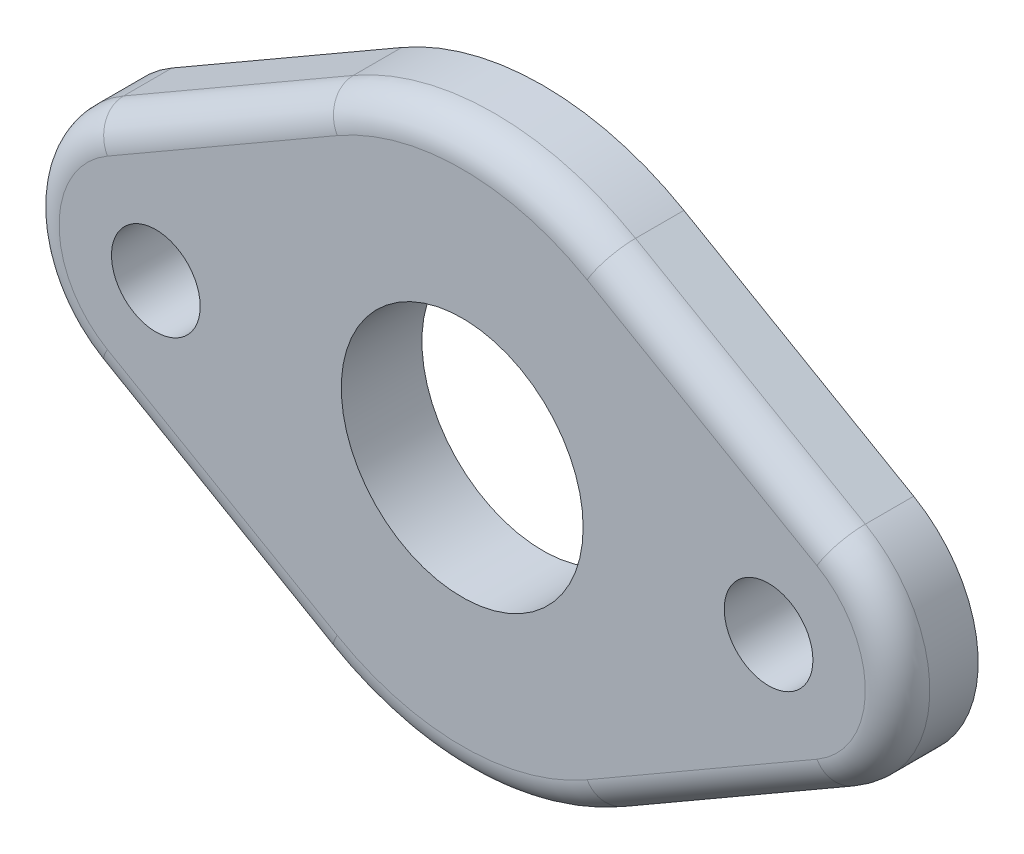
from build123d import *

# Parameters (mm, degrees)
SKETCH_1_R      = 2.75
SKETCH_1_R_2    = 7.5
EXTRUDE_1_DEPTH = 5
FILLET_1_R      = 2


with BuildPart() as part:
    # 草圖1 → 填料-伸長1 (new body)
    with BuildSketch(Plane.XY):
        with BuildLine():
            Line((-8.75, 100.155444566), (-23, 91.92820323))
            ThreePointArc((-23, 91.92820323), (-27, 85), (-23, 78.07179677))
            Line((-23, 78.07179677), (-8.75, 69.844555434))
            ThreePointArc((-8.75, 69.844555434), (0, 67.5), (8.75, 69.844555434))
            Line((8.75, 69.844555434), (23, 78.07179677))
            ThreePointArc((23, 78.07179677), (27, 85), (23, 91.92820323))
            Line((23, 91.92820323), (8.75, 100.155444566))
            ThreePointArc((8.75, 100.155444566), (0, 102.5), (-8.75, 100.155444566))
        make_face()
        with Locations((19, 85)):
            Circle(SKETCH_1_R, mode=Mode.SUBTRACT)
        with Locations((0, 85)):
            Circle(SKETCH_1_R_2, mode=Mode.SUBTRACT)
        with Locations((-19, 85)):
            Circle(SKETCH_1_R, mode=Mode.SUBTRACT)
    extrude(amount=EXTRUDE_1_DEPTH)

    # 圓角1
    fillet_1_edges = [part.edges().sort_by_distance(p)[0] for p in [
        (-27, 85, 5),
        (-15.875, 73.958176102, 5),
        (0, 67.5, 5),
        (15.875, 73.958176102, 5),
        (27, 85, 5),
        (15.875, 96.041823898, 5),
        (0, 102.5, 5),
        (-15.875, 96.041823898, 5),
    ]]
    fillet(fillet_1_edges, radius=FILLET_1_R)


solid = part.part
